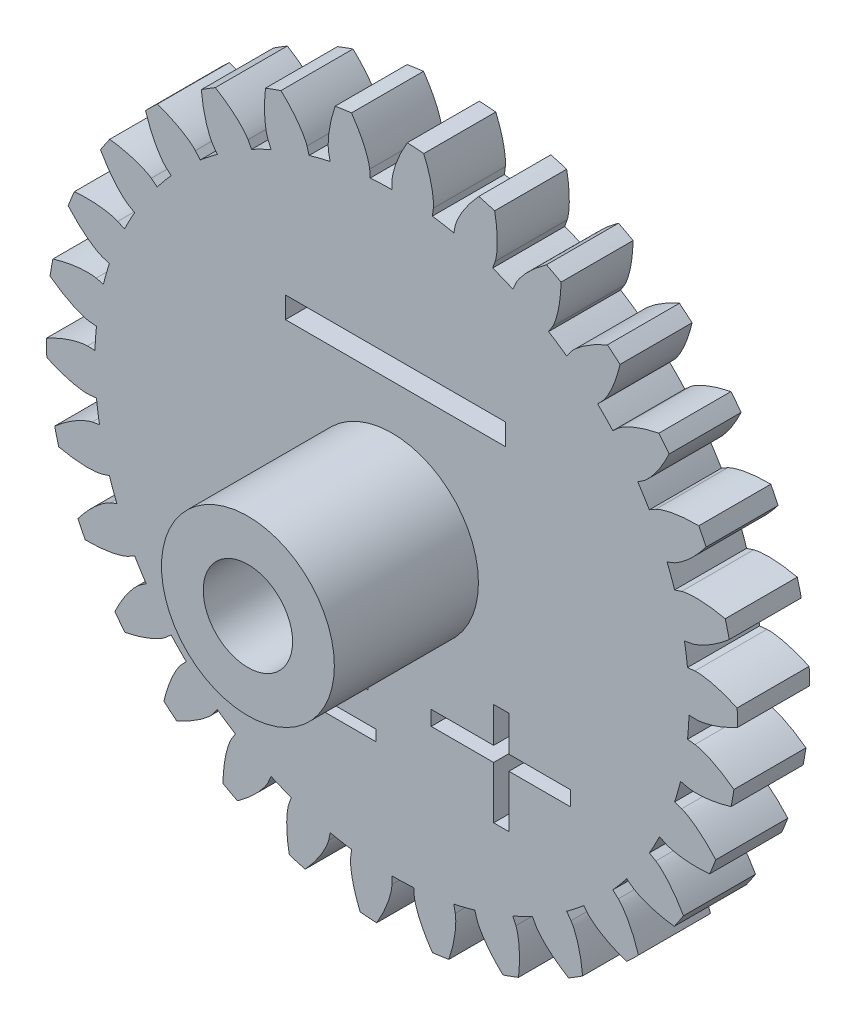
from build123d import *

# Parameters (mm, degrees)
EXTRUDE_1_DEPTH     = 5
SKETCH_3_R          = 3.1
CUT_EXTRUDE_1_DEPTH = 35.289661604
SKETCH_4_W          = 15.259984722
SKETCH_4_H          = 1.485485238
SKETCH_4_W_2        = 9.157676015
SKETCH_4_H_2        = 0.902934647
SKETCH_4_W_3        = 8.140290302
SKETCH_4_H_3        = 1.026013851
SKETCH_4_W_4        = 9.20419196
SKETCH_4_H_4        = 0.75747188
CUT_EXTRUDE_3_DEPTH = 35.289661604
EXTRUDE_START       = 10
SKETCH_5_R          = 6
SKETCH_5_R_2        = 3.1
EXTRUDE_3_DEPTH     = 10


with BuildPart() as part:
    # 草图2 → 凸台-拉伸1 (new body)
    with BuildSketch(Plane.XY):
        with BuildLine():
            ThreePointArc((2.204357203, 23.898552452), (1.633116974, 23.944371551), (1.060945599, 23.976538416))
            add(Edge.make_bspline(
                [(0, 21.143083968), (0.00037987, 21.160225435), (0.002621335, 21.208261377), (0.011495008, 21.298848828), (0.032544669, 21.445983805), (0.068954989, 21.632173974), (0.12697903, 21.870860387), (0.209261114, 22.149008274), (0.314210402, 22.450956335), (0.443724368, 22.774756342), (0.586524237, 23.093278709), (0.741139488, 23.406222172), (0.880596127, 23.665494038), (0.983335994, 23.845320999), (1.044263734, 23.948526579), (1.060945599, 23.976538416)],
                knots=[0, 0, 0, 0, 0, 0.005376748, 0.015083688, 0.02853182, 0.046610139, 0.064854849, 0.092110525, 0.119476175, 0.146842495, 0.174208853, 0.201574955, 0.228941013, 0.239167549, 0.239167549, 0.239167549, 0.239167549, 0.239167549], degree=4))
            add(Edge.make_bspline(
                [(0, 21.143083968), (0, 20.884041984), (0, 20.625)],
                knots=[0, 0, 0, 1, 1, 1], degree=2))
            ThreePointArc((0, 20.625), (-0.7551309, 20.611171784), (-1.509249231, 20.56970568))
            add(Edge.make_bspline(
                [(-1.547160398, 21.086400697), (-1.528204814, 20.828053189), (-1.509249231, 20.56970568)],
                knots=[0, 0, 0, 1, 1, 1], degree=2))
            add(Edge.make_bspline(
                [(-1.547160398, 21.086400697), (-1.548793589, 21.103468413), (-1.55454411, 21.151211552), (-1.570022795, 21.240906806), (-1.60178273, 21.386107), (-1.651720036, 21.569133653), (-1.727054569, 21.802934212), (-1.829469732, 22.074315352), (-1.956232924, 22.367774169), (-2.109093971, 22.681228811), (-2.274819106, 22.988447756), (-2.451919706, 23.289238155), (-2.609974876, 23.53761009), (-2.725598272, 23.709436882), (-2.793914811, 23.807907344), (-2.812601739, 23.834623376)],
                knots=[0, 0, 0, 0, 0, 0.005376748, 0.015083688, 0.02853182, 0.046610139, 0.064854849, 0.092110525, 0.119476175, 0.146842495, 0.174208853, 0.201574955, 0.228941013, 0.239167549, 0.239167549, 0.239167549, 0.239167549, 0.239167549], degree=4))
            ThreePointArc((-2.812601739, 23.834623376), (-3.380885325, 23.760673695), (-3.94724125, 23.673176519))
            add(Edge.make_bspline(
                [(-4.395894337, 20.681056855), (-4.399086679, 20.69790272), (-4.406881429, 20.745354988), (-4.417035858, 20.835807826), (-4.427037265, 20.984104021), (-4.43013371, 21.173795619), (-4.42300333, 21.419330038), (-4.400349503, 21.708507134), (-4.360472141, 22.025677089), (-4.301110173, 22.369328757), (-4.227655347, 22.710580408), (-4.141483415, 23.048831624), (-4.058979891, 23.331432443), (-3.995873263, 23.528690573), (-3.957734588, 23.642308453), (-3.94724125, 23.673176519)],
                knots=[0, 0, 0, 0, 0, 0.005376748, 0.015083688, 0.02853182, 0.046610139, 0.064854849, 0.092110525, 0.119476175, 0.146842495, 0.174208853, 0.201574955, 0.228941013, 0.239167549, 0.239167549, 0.239167549, 0.239167549, 0.239167549], degree=4))
            add(Edge.make_bspline(
                [(-4.395894337, 20.681056855), (-4.34203648, 20.42767556), (-4.288178623, 20.174294265)],
                knots=[0, 0, 0, 1, 1, 1], degree=2))
            ThreePointArc((-4.288178623, 20.174294265), (-5.023933053, 20.003767687), (-5.752950801, 19.806417699))
            add(Edge.make_bspline(
                [(-5.897460454, 20.303939516), (-5.825205628, 20.055178608), (-5.752950801, 19.806417699)],
                knots=[0, 0, 0, 1, 1, 1], degree=2))
            add(Edge.make_bspline(
                [(-5.897460454, 20.303939516), (-5.902606533, 20.320294701), (-5.918157748, 20.365798938), (-5.951946878, 20.450315936), (-6.013201601, 20.585739895), (-6.100101038, 20.754384427), (-6.2223992, 20.967412953), (-6.378999658, 21.211570454), (-6.564006288, 21.472260942), (-6.778697839, 21.74708425), (-7.004675893, 22.013133531), (-7.240444261, 22.270529653), (-7.446684975, 22.480612547), (-7.595506521, 22.624645056), (-7.68280334, 22.706759894), (-7.706636489, 22.729006886)],
                knots=[0, 0, 0, 0, 0, 0.005376748, 0.015083688, 0.02853182, 0.046610139, 0.064854849, 0.092110525, 0.119476175, 0.146842495, 0.174208853, 0.201574955, 0.228941013, 0.239167549, 0.239167549, 0.239167549, 0.239167549, 0.239167549], degree=4))
            ThreePointArc((-7.706636489, 22.729006886), (-8.247126712, 22.538520382), (-8.782914716, 22.335183212))
            add(Edge.make_bspline(
                [(-8.599666997, 19.315168319), (-8.606292031, 19.330982336), (-8.623782329, 19.375777039), (-8.652521061, 19.46214204), (-8.693136426, 19.605118199), (-8.735604308, 19.790020793), (-8.779679219, 20.031672186), (-8.817643732, 20.319240063), (-8.844581128, 20.637770063), (-8.857965561, 20.986254165), (-8.857066107, 21.335320766), (-8.843103621, 21.684096533), (-8.82115901, 21.977675294), (-8.800443685, 22.183743466), (-8.786760916, 22.302807999), (-8.782914716, 22.335183212)],
                knots=[0, 0, 0, 0, 0, 0.005376748, 0.015083688, 0.02853182, 0.046610139, 0.064854849, 0.092110525, 0.119476175, 0.146842495, 0.174208853, 0.201574955, 0.228941013, 0.239167549, 0.239167549, 0.239167549, 0.239167549, 0.239167549], degree=4))
            add(Edge.make_bspline(
                [(-8.599666997, 19.315168319), (-8.49430513, 19.078521692), (-8.388943263, 18.841875064)],
                knots=[0, 0, 0, 1, 1, 1], degree=2))
            ThreePointArc((-8.388943263, 18.841875064), (-9.073165225, 18.522102953), (-9.745220816, 18.177494223))
            add(Edge.make_bspline(
                [(-9.990013188, 18.634098748), (-9.867617002, 18.405796486), (-9.745220816, 18.177494223)],
                knots=[0, 0, 0, 1, 1, 1], degree=2))
            add(Edge.make_bspline(
                [(-9.990013188, 18.634098748), (-9.998447248, 18.649026603), (-10.023119494, 18.690303184), (-10.073742323, 18.765948128), (-10.161814707, 18.885677175), (-10.281878352, 19.032569011), (-10.445795127, 19.215515135), (-10.649736688, 19.421778143), (-10.88490108, 19.638306877), (-11.152040084, 19.862487753), (-11.428394731, 20.075739739), (-11.712526657, 20.278492138), (-11.957939207, 20.441104361), (-12.133454687, 20.551047675), (-12.235916496, 20.613218079), (-12.263854244, 20.63002373)],
                knots=[0, 0, 0, 0, 0, 0.005376748, 0.015083688, 0.02853182, 0.046610139, 0.064854849, 0.092110525, 0.119476175, 0.146842495, 0.174208853, 0.201574955, 0.228941013, 0.239167549, 0.239167549, 0.239167549, 0.239167549, 0.239167549], degree=4))
            ThreePointArc((-12.263854244, 20.63002373), (-12.752929087, 20.331325576), (-13.234732663, 20.021035222))
            add(Edge.make_bspline(
                [(-12.427592944, 17.105114243), (-12.437361125, 17.119205264), (-12.463782559, 17.159384657), (-12.509849575, 17.237887258), (-12.579303811, 17.369294635), (-12.659287079, 17.541327095), (-12.752640998, 17.768534136), (-12.849564619, 18.041924699), (-12.942139479, 18.347893455), (-13.027685348, 18.685979563), (-13.099380576, 19.027605228), (-13.158237764, 19.371662372), (-13.197811152, 19.663388273), (-13.220392489, 19.86926032), (-13.23176363, 19.988567815), (-13.234732663, 20.021035222)],
                knots=[0, 0, 0, 0, 0, 0.005376748, 0.015083688, 0.02853182, 0.046610139, 0.064854849, 0.092110525, 0.119476175, 0.146842495, 0.174208853, 0.201574955, 0.228941013, 0.239167549, 0.239167549, 0.239167549, 0.239167549, 0.239167549], degree=4))
            add(Edge.make_bspline(
                [(-12.427592944, 17.105114243), (-12.275331886, 16.895544876), (-12.123070829, 16.685975509)],
                knots=[0, 0, 0, 1, 1, 1], degree=2))
            ThreePointArc((-12.123070829, 16.685975509), (-12.725856538, 16.230933441), (-13.311577919, 15.754127025))
            add(Edge.make_bspline(
                [(-13.645954409, 16.149858449), (-13.478766164, 15.951992737), (-13.311577919, 15.754127025)],
                knots=[0, 0, 0, 1, 1, 1], degree=2))
            add(Edge.make_bspline(
                [(-13.645954409, 16.149858449), (-13.65730784, 16.162706555), (-13.690022822, 16.197951495), (-13.755266888, 16.261418338), (-13.866307748, 16.36021974), (-14.014288245, 16.478939001), (-14.212659683, 16.6238071), (-14.455029122, 16.78316093), (-14.730073464, 16.946064566), (-15.037984664, 17.10980523), (-15.35263788, 17.260939787), (-15.672715436, 17.400187211), (-15.946574115, 17.508221828), (-16.141112661, 17.579270897), (-16.254261388, 17.618779719), (-16.285082719, 17.629409543)],
                knots=[0, 0, 0, 0, 0, 0.005376748, 0.015083688, 0.02853182, 0.046610139, 0.064854849, 0.092110525, 0.119476175, 0.146842495, 0.174208853, 0.201574955, 0.228941013, 0.239167549, 0.239167549, 0.239167549, 0.239167549, 0.239167549], degree=4))
            ThreePointArc((-16.285082719, 17.629409543), (-16.701367266, 17.235554283), (-17.108129285, 16.831871921))
            add(Edge.make_bspline(
                [(-15.712373445, 14.147484596), (-15.724857855, 14.159236775), (-15.759055684, 14.193044827), (-15.820437633, 14.260254086), (-15.915695258, 14.374349549), (-16.029698259, 14.525993231), (-16.16825117, 14.728825881), (-16.319897872, 14.976090651), (-16.47406423, 15.25612586), (-16.628032772, 15.569037989), (-16.769189257, 15.888292037), (-16.898293776, 16.21259361), (-16.997655616, 16.48971683), (-17.062546702, 16.686395155), (-17.098474779, 16.800731302), (-17.108129285, 16.831871921)],
                knots=[0, 0, 0, 0, 0, 0.005376748, 0.015083688, 0.02853182, 0.046610139, 0.064854849, 0.092110525, 0.119476175, 0.146842495, 0.174208853, 0.201574955, 0.228941013, 0.239167549, 0.239167549, 0.239167549, 0.239167549, 0.239167549], degree=4))
            add(Edge.make_bspline(
                [(-15.712373445, 14.147484596), (-15.519867735, 13.974151676), (-15.327362025, 13.800818756)],
                knots=[0, 0, 0, 1, 1, 1], degree=2))
            ThreePointArc((-15.327362025, 13.800818756), (-15.822366855, 13.230394253), (-16.296155191, 12.642228878))
            add(Edge.make_bspline(
                [(-16.705501942, 12.95979184), (-16.500828566, 12.801010359), (-16.296155191, 12.642228878)],
                knots=[0, 0, 0, 1, 1, 1], degree=2))
            add(Edge.make_bspline(
                [(-16.705501942, 12.95979184), (-16.719278544, 12.969998673), (-16.75860646, 12.9976716), (-16.835620286, 13.046186535), (-16.964776603, 13.119742197), (-17.134206494, 13.205100282), (-17.358362811, 13.305558924), (-17.628567421, 13.411039051), (-17.931470954, 13.513197917), (-18.266697154, 13.609342117), (-18.605897083, 13.691753939), (-18.947931344, 13.761410606), (-19.238267214, 13.810145987), (-19.443326558, 13.839195625), (-19.56221706, 13.854316142), (-19.594574936, 13.858305563)],
                knots=[0, 0, 0, 0, 0, 0.005376748, 0.015083688, 0.02853182, 0.046610139, 0.064854849, 0.092110525, 0.119476175, 0.146842495, 0.174208853, 0.201574955, 0.228941013, 0.239167549, 0.239167549, 0.239167549, 0.239167549, 0.239167549], degree=4))
            ThreePointArc((-19.594574936, 13.858305563), (-19.919875554, 13.386506562), (-20.233818564, 12.907075049))
            add(Edge.make_bspline(
                [(-18.31044783, 10.571541984), (-18.325102842, 10.580441695), (-18.365582455, 10.606400832), (-18.439596652, 10.659379383), (-18.55649445, 10.751176412), (-18.699534706, 10.875803759), (-18.877231183, 11.045397259), (-19.076973277, 11.255729578), (-19.285993324, 11.497592357), (-19.501655373, 11.771654746), (-19.7061039, 12.054584244), (-19.899813264, 12.34495671), (-20.054620966, 12.595365635), (-20.158985749, 12.774254451), (-20.217900534, 12.878622212), (-20.233818564, 12.907075049)],
                knots=[0, 0, 0, 0, 0, 0.005376748, 0.015083688, 0.02853182, 0.046610139, 0.064854849, 0.092110525, 0.119476175, 0.146842495, 0.174208853, 0.201574955, 0.228941013, 0.239167549, 0.239167549, 0.239167549, 0.239167549, 0.239167549], degree=4))
            add(Edge.make_bspline(
                [(-18.31044783, 10.571541984), (-18.086110892, 10.442020992), (-17.861773953, 10.3125)],
                knots=[0, 0, 0, 1, 1, 1], degree=2))
            ThreePointArc((-17.861773953, 10.3125), (-18.227363817, 9.65162335), (-18.568512283, 8.977804666))
            add(Edge.make_bspline(
                [(-19.034938877, 9.20332014), (-18.80172558, 9.090562403), (-18.568512283, 8.977804666)],
                knots=[0, 0, 0, 1, 1, 1], degree=2))
            add(Edge.make_bspline(
                [(-19.034938877, 9.20332014), (-19.050536548, 9.210439613), (-19.09475858, 9.229331085), (-19.180176291, 9.260773778), (-19.321803315, 9.305868964), (-19.505277699, 9.354135315), (-19.745422189, 9.405793976), (-20.031652732, 9.452790412), (-20.349177118, 9.489739676), (-20.697067325, 9.514085448), (-21.045989303, 9.524172743), (-21.395031731, 9.521194324), (-21.68915572, 9.508500499), (-21.895773785, 9.494281097), (-22.015209976, 9.484352469), (-22.047690202, 9.481527131)],
                knots=[0, 0, 0, 0, 0, 0.005376748, 0.015083688, 0.02853182, 0.046610139, 0.064854849, 0.092110525, 0.119476175, 0.146842495, 0.174208853, 0.201574955, 0.228941013, 0.239167549, 0.239167549, 0.239167549, 0.239167549, 0.239167549], degree=4))
            ThreePointArc((-22.047690202, 9.481527131), (-22.267789693, 8.952404268), (-22.475192879, 8.418177062))
            add(Edge.make_bspline(
                [(-20.108267782, 6.53357226), (-20.1244529, 6.539230543), (-20.169445145, 6.556206225), (-20.252856814, 6.592638651), (-20.38628579, 6.658125276), (-20.552111756, 6.750289474), (-20.76118561, 6.879231775), (-21.000293408, 7.043439112), (-21.255031965, 7.236558897), (-21.522962056, 7.459793704), (-21.781767242, 7.694033275), (-22.031615422, 7.937785965), (-22.235103147, 8.150536523), (-22.374380386, 8.30381753), (-22.453707018, 8.393655532), (-22.475192879, 8.418177062)],
                knots=[0, 0, 0, 0, 0, 0.005376748, 0.015083688, 0.02853182, 0.046610139, 0.064854849, 0.092110525, 0.119476175, 0.146842495, 0.174208853, 0.201574955, 0.228941013, 0.239167549, 0.239167549, 0.239167549, 0.239167549, 0.239167549], degree=4))
            add(Edge.make_bspline(
                [(-20.108267782, 6.53357226), (-19.861904215, 6.453523884), (-19.615540649, 6.373475509)],
                knots=[0, 0, 0, 1, 1, 1], degree=2))
            ThreePointArc((-19.615540649, 6.373475509), (-19.835737515, 5.651030193), (-20.029336286, 4.921007309))
            add(Edge.make_bspline(
                [(-20.532457644, 5.044619187), (-20.280896965, 4.982813248), (-20.029336286, 4.921007309)],
                knots=[0, 0, 0, 1, 1, 1], degree=2))
            add(Edge.make_bspline(
                [(-20.532457644, 5.044619187), (-20.54919469, 5.048340144), (-20.596378122, 5.057624516), (-20.686466555, 5.070620769), (-20.834374505, 5.085284603), (-21.023874673, 5.094349749), (-21.269511869, 5.094950697), (-21.559258696, 5.081409472), (-21.877526597, 5.051534275), (-22.222876338, 5.003017592), (-22.566270801, 4.940339497), (-22.907066565, 4.864856162), (-23.192124045, 4.791287911), (-23.39127063, 4.734420926), (-23.506032576, 4.699877083), (-23.537215611, 4.690360466)],
                knots=[0, 0, 0, 0, 0, 0.005376748, 0.015083688, 0.02853182, 0.046610139, 0.064854849, 0.092110525, 0.119476175, 0.146842495, 0.174208853, 0.201574955, 0.228941013, 0.239167549, 0.239167549, 0.239167549, 0.239167549, 0.239167549], degree=4))
            ThreePointArc((-23.537215611, 4.690360466), (-23.64249457, 4.12703895), (-23.734293417, 3.561364343))
            add(Edge.make_bspline(
                [(-21.027259941, 2.210054076), (-21.044267799, 2.212223637), (-21.091806298, 2.219473946), (-21.18096995, 2.237767974), (-21.325098617, 2.274082116), (-21.506462902, 2.329755149), (-21.737776603, 2.412410852), (-22.005799947, 2.523316558), (-22.295123716, 2.659253089), (-22.603612018, 2.821903881), (-22.905462834, 2.997216131), (-23.200530266, 3.183695883), (-23.443804625, 3.349489853), (-23.611907235, 3.470463937), (-23.708178761, 3.541845829), (-23.734293417, 3.561364343)],
                knots=[0, 0, 0, 0, 0, 0.005376748, 0.015083688, 0.02853182, 0.046610139, 0.064854849, 0.092110525, 0.119476175, 0.146842495, 0.174208853, 0.201574955, 0.228941013, 0.239167549, 0.239167549, 0.239167549, 0.239167549, 0.239167549], degree=4))
            add(Edge.make_bspline(
                [(-21.027259941, 2.210054076), (-20.769637017, 2.182976815), (-20.512014092, 2.155899555)],
                knots=[0, 0, 0, 1, 1, 1], degree=2))
            ThreePointArc((-20.512014092, 2.155899555), (-20.577194301, 1.403459899), (-20.614782183, 0.649138319))
            add(Edge.make_bspline(
                [(-21.132609487, 0.665444169), (-20.873695835, 0.657291244), (-20.614782183, 0.649138319)],
                knots=[0, 0, 0, 1, 1, 1], degree=2))
            add(Edge.make_bspline(
                [(-21.132609487, 0.665444169), (-21.149754418, 0.665603987), (-21.197837109, 0.664875485), (-21.288658966, 0.658857301), (-21.436383555, 0.642448903), (-21.623627439, 0.611916654), (-21.864021817, 0.561433625), (-22.144621602, 0.487946556), (-22.449723183, 0.392552585), (-22.777439018, 0.273293859), (-23.100297979, 0.140589708), (-23.417952671, -0.004099559), (-23.681485262, -0.135326949), (-23.864456705, -0.232356157), (-23.969528758, -0.290005485), (-23.998051752, -0.305797458)],
                knots=[0, 0, 0, 0, 0, 0.005376748, 0.015083688, 0.02853182, 0.046610139, 0.064854849, 0.092110525, 0.119476175, 0.146842495, 0.174208853, 0.201574955, 0.228941013, 0.239167549, 0.239167549, 0.239167549, 0.239167549, 0.239167549], degree=4))
            ThreePointArc((-23.998051752, -0.305797458), (-23.983908985, -0.878697774), (-23.956091443, -1.451097087))
            add(Edge.make_bspline(
                [(-21.027259941, -2.210054076), (-21.044347214, -2.211468058), (-21.092354306, -2.214259995), (-21.183373061, -2.2149039), (-21.331902306, -2.209349345), (-21.52087842, -2.192600657), (-21.764322448, -2.159844002), (-22.049547432, -2.107087038), (-22.360811577, -2.03427484), (-22.69637567, -1.939316682), (-23.028079789, -1.830593739), (-23.35547061, -1.709536986), (-23.627899345, -1.597945595), (-23.817480436, -1.514565583), (-23.926489328, -1.464759533), (-23.956091443, -1.451097087)],
                knots=[0, 0, 0, 0, 0, 0.005376748, 0.015083688, 0.02853182, 0.046610139, 0.064854849, 0.092110525, 0.119476175, 0.146842495, 0.174208853, 0.201574955, 0.228941013, 0.239167549, 0.239167549, 0.239167549, 0.239167549, 0.239167549], degree=4))
            add(Edge.make_bspline(
                [(-21.027259941, -2.210054076), (-20.769637017, -2.182976815), (-20.512014092, -2.155899555)],
                knots=[0, 0, 0, 1, 1, 1], degree=2))
            ThreePointArc((-20.512014092, -2.155899555), (-20.419328956, -2.905448326), (-20.299263177, -3.65110113))
            add(Edge.make_bspline(
                [(-20.809164889, -3.742813952), (-20.554214033, -3.696957541), (-20.299263177, -3.65110113)],
                knots=[0, 0, 0, 1, 1, 1], degree=2))
            add(Edge.make_bspline(
                [(-20.809164889, -3.742813952), (-20.825968391, -3.746222259), (-20.872848895, -3.756931794), (-20.960434826, -3.781701392), (-21.10151978, -3.828464897), (-21.278323925, -3.897260136), (-21.502969097, -3.996620791), (-21.762158283, -4.126841967), (-22.04075914, -4.283585536), (-22.336518315, -4.468374126), (-22.624731289, -4.665304526), (-22.905361873, -4.872876109), (-23.135851936, -5.056027373), (-23.294651507, -5.188978162), (-23.385441515, -5.267213422), (-23.410057877, -5.288590566)],
                knots=[0, 0, 0, 0, 0, 0.005376748, 0.015083688, 0.02853182, 0.046610139, 0.064854849, 0.092110525, 0.119476175, 0.146842495, 0.174208853, 0.201574955, 0.228941013, 0.239167549, 0.239167549, 0.239167549, 0.239167549, 0.239167549], degree=4))
            ThreePointArc((-23.410057877, -5.288590566), (-23.27711149, -5.846031189), (-23.130893319, -6.400138612))
            add(Edge.make_bspline(
                [(-20.108267782, -6.53357226), (-20.124687673, -6.538507986), (-20.171065219, -6.551220148), (-20.25996112, -6.570773846), (-20.406399502, -6.596221638), (-20.594728282, -6.619129292), (-20.839662966, -6.637703308), (-21.129623889, -6.645400819), (-21.449224673, -6.638895197), (-21.797198797, -6.615779801), (-22.144259155, -6.578397879), (-22.489664816, -6.528054886), (-22.779341484, -6.475543153), (-22.982115452, -6.43340132), (-23.099097499, -6.407347874), (-23.130893319, -6.400138612)],
                knots=[0, 0, 0, 0, 0, 0.005376748, 0.015083688, 0.02853182, 0.046610139, 0.064854849, 0.092110525, 0.119476175, 0.146842495, 0.174208853, 0.201574955, 0.228941013, 0.239167549, 0.239167549, 0.239167549, 0.239167549, 0.239167549], degree=4))
            add(Edge.make_bspline(
                [(-20.108267782, -6.53357226), (-19.861904215, -6.453523884), (-19.615540649, -6.373475509)],
                knots=[0, 0, 0, 1, 1, 1], degree=2))
            ThreePointArc((-19.615540649, -6.373475509), (-19.369040953, -7.087374518), (-19.096568964, -7.79176994))
            add(Edge.make_bspline(
                [(-19.576259932, -7.987493144), (-19.336414448, -7.889631542), (-19.096568964, -7.79176994)],
                knots=[0, 0, 0, 1, 1, 1], degree=2))
            add(Edge.make_bspline(
                [(-19.576259932, -7.987493144), (-19.59198761, -7.994320615), (-19.635617026, -8.014543127), (-19.716139105, -8.056981588), (-19.844418335, -8.13205641), (-20.00305555, -8.236107956), (-20.202133445, -8.3800037), (-20.42858422, -8.561267693), (-20.66850816, -8.772510414), (-20.919384579, -9.01475272), (-21.160355275, -9.267302565), (-21.391696849, -9.52868459), (-21.579070862, -9.755755138), (-21.706758259, -9.918816921), (-21.779298261, -10.014218857), (-21.798932139, -10.040246889)],
                knots=[0, 0, 0, 0, 0, 0.005376748, 0.015083688, 0.02853182, 0.046610139, 0.064854849, 0.092110525, 0.119476175, 0.146842495, 0.174208853, 0.201574955, 0.228941013, 0.239167549, 0.239167549, 0.239167549, 0.239167549, 0.239167549], degree=4))
            ThreePointArc((-21.798932139, -10.040246889), (-21.552992527, -10.557864989), (-21.294764163, -11.069463368))
            add(Edge.make_bspline(
                [(-18.31044783, -10.571541984), (-18.325482712, -10.57978374), (-18.36820379, -10.601860545), (-18.45109166, -10.639469445), (-18.589039118, -10.694807393), (-18.768489694, -10.756370215), (-19.004210213, -10.825463128), (-19.286234391, -10.893278696), (-19.600203726, -10.953363977), (-19.945379742, -11.003101596), (-20.292628137, -11.038694465), (-20.640952752, -11.061265462), (-20.935217093, -11.070128402), (-21.142321743, -11.071066548), (-21.262164268, -11.069904368), (-21.294764163, -11.069463368)],
                knots=[0, 0, 0, 0, 0, 0.005376748, 0.015083688, 0.02853182, 0.046610139, 0.064854849, 0.092110525, 0.119476175, 0.146842495, 0.174208853, 0.201574955, 0.228941013, 0.239167549, 0.239167549, 0.239167549, 0.239167549, 0.239167549], degree=4))
            add(Edge.make_bspline(
                [(-18.31044783, -10.571541984), (-18.086110892, -10.442020992), (-17.861773953, -10.3125)],
                knots=[0, 0, 0, 1, 1, 1], degree=2))
            ThreePointArc((-17.861773953, -10.3125), (-17.472232917, -10.959548434), (-17.059263052, -11.591901014))
            add(Edge.make_bspline(
                [(-17.487778479, -11.883080557), (-17.273520766, -11.737490786), (-17.059263052, -11.591901014)],
                knots=[0, 0, 0, 1, 1, 1], degree=2))
            add(Edge.make_bspline(
                [(-17.487778479, -11.883080557), (-17.501742959, -11.8930288), (-17.54021447, -11.921880466), (-17.610153496, -11.980133028), (-17.720020585, -12.080238036), (-17.853557663, -12.214998338), (-18.018367621, -12.397140236), (-18.202183, -12.62152494), (-18.392944194, -12.878034492), (-18.587973354, -13.167143363), (-18.771170197, -13.464275013), (-18.943112024, -13.768043831), (-19.079180844, -14.029109591), (-19.170175513, -14.215155785), (-19.221295165, -14.323554874), (-19.235088463, -14.353096244)],
                knots=[0, 0, 0, 0, 0, 0.005376748, 0.015083688, 0.02853182, 0.046610139, 0.064854849, 0.092110525, 0.119476175, 0.146842495, 0.174208853, 0.201574955, 0.228941013, 0.239167549, 0.239167549, 0.239167549, 0.239167549, 0.239167549], degree=4))
            ThreePointArc((-19.235088463, -14.353096244), (-18.886904368, -14.808269426), (-18.527951629, -15.254999457))
            add(Edge.make_bspline(
                [(-15.712373445, -14.147484596), (-15.725366221, -14.158672178), (-15.762563715, -14.189148763), (-15.835820956, -14.243169175), (-15.959248526, -14.325978745), (-16.121978046, -14.423506145), (-16.33818228, -14.540098264), (-16.599943905, -14.665068023), (-16.894559824, -14.789118191), (-17.221851883, -14.909535053), (-17.554111894, -15.016547133), (-17.890132006, -15.111045659), (-18.176123257, -15.18089592), (-18.378507122, -15.224873043), (-18.495972431, -15.248652921), (-18.527951629, -15.254999457)],
                knots=[0, 0, 0, 0, 0, 0.005376748, 0.015083688, 0.02853182, 0.046610139, 0.064854849, 0.092110525, 0.119476175, 0.146842495, 0.174208853, 0.201574955, 0.228941013, 0.239167549, 0.239167549, 0.239167549, 0.239167549, 0.239167549], degree=4))
            add(Edge.make_bspline(
                [(-15.712373445, -14.147484596), (-15.519867735, -13.974151676), (-15.327362025, -13.800818756)],
                knots=[0, 0, 0, 1, 1, 1], degree=2))
            ThreePointArc((-15.327362025, -13.800818756), (-14.811804462, -14.352737494), (-14.276385485, -14.88541039))
            add(Edge.make_bspline(
                [(-14.634997191, -15.259320329), (-14.455691338, -15.072365359), (-14.276385485, -14.88541039)],
                knots=[0, 0, 0, 1, 1, 1], degree=2))
            add(Edge.make_bspline(
                [(-14.634997191, -15.259320329), (-14.646588157, -15.271954557), (-14.678220375, -15.308174422), (-14.734519677, -15.379695166), (-14.821172904, -15.500455292), (-14.923773635, -15.660034678), (-15.047112669, -15.872462256), (-15.180259038, -16.130160981), (-15.313520308, -16.420726667), (-15.444178499, -16.744066658), (-15.561594908, -17.072794034), (-15.666622305, -17.405673491), (-15.745439071, -17.689324635), (-15.79576411, -17.89022413), (-15.823229236, -18.006882812), (-15.830579122, -18.03864642)],
                knots=[0, 0, 0, 0, 0, 0.005376748, 0.015083688, 0.02853182, 0.046610139, 0.064854849, 0.092110525, 0.119476175, 0.146842495, 0.174208853, 0.201574955, 0.228941013, 0.239167549, 0.239167549, 0.239167549, 0.239167549, 0.239167549], degree=4))
            ThreePointArc((-15.830579122, -18.03864642), (-15.395367858, -18.411481432), (-14.951378702, -18.773818869))
            add(Edge.make_bspline(
                [(-12.427592944, -17.105114243), (-12.437975768, -17.1187587), (-12.468023969, -17.156303093), (-12.528448888, -17.224374066), (-12.631962191, -17.331036083), (-12.770858594, -17.460265645), (-12.958097383, -17.619261334), (-13.188156214, -17.795923506), (-13.450542588, -17.978516974), (-13.745646457, -18.164350284), (-14.048396728, -18.338104634), (-14.357426646, -18.50040065), (-14.622645615, -18.62818544), (-14.81146355, -18.713279529), (-14.921417845, -18.76096217), (-14.951378702, -18.773818869)],
                knots=[0, 0, 0, 0, 0, 0.005376748, 0.015083688, 0.02853182, 0.046610139, 0.064854849, 0.092110525, 0.119476175, 0.146842495, 0.174208853, 0.201574955, 0.228941013, 0.239167549, 0.239167549, 0.239167549, 0.239167549, 0.239167549], degree=4))
            add(Edge.make_bspline(
                [(-12.427592944, -17.105114243), (-12.275331886, -16.895544876), (-12.123070829, -16.685975509)],
                knots=[0, 0, 0, 1, 1, 1], degree=2))
            ThreePointArc((-12.123070829, -16.685975509), (-11.504029077, -17.118643054), (-10.869561366, -17.528355904))
            add(Edge.make_bspline(
                [(-11.142596299, -17.968654579), (-11.006078832, -17.748505242), (-10.869561366, -17.528355904)],
                knots=[0, 0, 0, 1, 1, 1], degree=2))
            add(Edge.make_bspline(
                [(-11.142596299, -17.968654579), (-11.151307171, -17.983422617), (-11.174717615, -18.025427699), (-11.214916643, -18.107090826), (-11.274568848, -18.243228272), (-11.341749087, -18.420652357), (-11.41822669, -18.65408151), (-11.494884914, -18.933831587), (-11.564822102, -19.245754292), (-11.625398934, -19.589193893), (-11.671903248, -19.935150031), (-11.705426014, -20.282591697), (-11.723546055, -20.576431311), (-11.731002018, -20.783403833), (-11.733612262, -20.903223564), (-11.734197509, -20.935821188)],
                knots=[0, 0, 0, 0, 0, 0.005376748, 0.015083688, 0.02853182, 0.046610139, 0.064854849, 0.092110525, 0.119476175, 0.146842495, 0.174208853, 0.201574955, 0.228941013, 0.239167549, 0.239167549, 0.239167549, 0.239167549, 0.239167549], degree=4))
            ThreePointArc((-11.734197509, -20.935821188), (-11.230979898, -21.21002335), (-10.721358781, -21.472132309))
            add(Edge.make_bspline(
                [(-8.599666997, -19.315168319), (-8.606986089, -19.330673322), (-8.628571747, -19.373644652), (-8.673523486, -19.452791158), (-8.752598494, -19.57864398), (-8.861591341, -19.733927752), (-9.011681451, -19.928378137), (-9.199982813, -20.149011737), (-9.418672099, -20.382168295), (-9.668690323, -20.625296246), (-9.928699212, -20.858198967), (-10.197232846, -21.081199358), (-10.430088193, -21.261333868), (-10.597087947, -21.383825903), (-10.694725698, -21.453327348), (-10.721358781, -21.472132309)],
                knots=[0, 0, 0, 0, 0, 0.005376748, 0.015083688, 0.02853182, 0.046610139, 0.064854849, 0.092110525, 0.119476175, 0.146842495, 0.174208853, 0.201574955, 0.228941013, 0.239167549, 0.239167549, 0.239167549, 0.239167549, 0.239167549], degree=4))
            add(Edge.make_bspline(
                [(-8.599666997, -19.315168319), (-8.49430513, -19.078521692), (-8.388943263, -18.841875064)],
                knots=[0, 0, 0, 1, 1, 1], degree=2))
            ThreePointArc((-8.388943263, -18.841875064), (-7.693472418, -19.136381767), (-6.987685258, -19.405228155))
            add(Edge.make_bspline(
                [(-7.16321048, -19.892672402), (-7.075447869, -19.648950278), (-6.987685258, -19.405228155)],
                knots=[0, 0, 0, 1, 1, 1], degree=2))
            add(Edge.make_bspline(
                [(-7.16321048, -19.892672402), (-7.168660551, -19.908928814), (-7.182826073, -19.95488329), (-7.205167938, -20.04311973), (-7.235212032, -20.188684637), (-7.26403568, -20.376199137), (-7.290309414, -20.620427891), (-7.30712916, -20.910002898), (-7.310685676, -21.229650102), (-7.298533651, -21.578179356), (-7.272093409, -21.926244313), (-7.232646437, -22.273063319), (-7.189277821, -22.564249201), (-7.153538846, -22.768249059), (-7.131180127, -22.885993141), (-7.124975158, -22.918000109)],
                knots=[0, 0, 0, 0, 0, 0.005376748, 0.015083688, 0.02853182, 0.046610139, 0.064854849, 0.092110525, 0.119476175, 0.146842495, 0.174208853, 0.201574955, 0.228941013, 0.239167549, 0.239167549, 0.239167549, 0.239167549, 0.239167549], degree=4))
            ThreePointArc((-7.124975158, -22.918000109), (-6.575744224, -23.081585472), (-6.022764034, -23.232010533))
            add(Edge.make_bspline(
                [(-4.395894337, -20.681056855), (-4.399829818, -20.697744761), (-4.412009535, -20.744264975), (-4.439523487, -20.831027933), (-4.490704244, -20.970571187), (-4.565030024, -21.145122523), (-4.671411796, -21.366529189), (-4.809726017, -21.62149147), (-4.975160443, -21.895021057), (-5.169166025, -22.18481779), (-5.375069898, -22.466689916), (-5.59137104, -22.740648496), (-5.781685868, -22.965259983), (-5.919568751, -23.119796474), (-6.00062272, -23.208079176), (-6.022764034, -23.232010533)],
                knots=[0, 0, 0, 0, 0, 0.005376748, 0.015083688, 0.02853182, 0.046610139, 0.064854849, 0.092110525, 0.119476175, 0.146842495, 0.174208853, 0.201574955, 0.228941013, 0.239167549, 0.239167549, 0.239167549, 0.239167549, 0.239167549], degree=4))
            add(Edge.make_bspline(
                [(-4.395894337, -20.681056855), (-4.34203648, -20.42767556), (-4.288178623, -20.174294265)],
                knots=[0, 0, 0, 1, 1, 1], degree=2))
            ThreePointArc((-4.288178623, -20.174294265), (-3.546674098, -20.317768771), (-2.800413774, -20.433998818))
            add(Edge.make_bspline(
                [(-2.870757991, -20.947284985), (-2.835585882, -20.690641901), (-2.800413774, -20.433998818)],
                knots=[0, 0, 0, 1, 1, 1], degree=2))
            add(Edge.make_bspline(
                [(-2.870757991, -20.947284985), (-2.872709066, -20.964319289), (-2.877010565, -21.012214726), (-2.880518819, -21.103168124), (-2.879641732, -21.251798606), (-2.868849057, -21.441208238), (-2.843770634, -21.685562624), (-2.800016799, -21.972306745), (-2.737037206, -22.285708332), (-2.652687425, -22.624094837), (-2.554458192, -22.959056504), (-2.443765505, -23.290095197), (-2.340803648, -23.565901126), (-2.2634317, -23.758012546), (-2.217081201, -23.868534999), (-2.204357203, -23.898552452)],
                knots=[0, 0, 0, 0, 0, 0.005376748, 0.015083688, 0.02853182, 0.046610139, 0.064854849, 0.092110525, 0.119476175, 0.146842495, 0.174208853, 0.201574955, 0.228941013, 0.239167549, 0.239167549, 0.239167549, 0.239167549, 0.239167549], degree=4))
            ThreePointArc((-2.204357203, -23.898552452), (-1.633116974, -23.944371551), (-1.060945599, -23.976538416))
            add(Edge.make_bspline(
                [(0, -21.143083968), (-0.00037987, -21.160225435), (-0.002621335, -21.208261377), (-0.011495008, -21.298848828), (-0.032544669, -21.445983805), (-0.068954989, -21.632173974), (-0.12697903, -21.870860387), (-0.209261114, -22.149008274), (-0.314210402, -22.450956335), (-0.443724368, -22.774756342), (-0.586524237, -23.093278709), (-0.741139488, -23.406222172), (-0.880596127, -23.665494038), (-0.983335994, -23.845320999), (-1.044263734, -23.948526579), (-1.060945599, -23.976538416)],
                knots=[0, 0, 0, 0, 0, 0.005376748, 0.015083688, 0.02853182, 0.046610139, 0.064854849, 0.092110525, 0.119476175, 0.146842495, 0.174208853, 0.201574955, 0.228941013, 0.239167549, 0.239167549, 0.239167549, 0.239167549, 0.239167549], degree=4))
            add(Edge.make_bspline(
                [(0, -21.143083968), (0, -20.884041984), (0, -20.625)],
                knots=[0, 0, 0, 1, 1, 1], degree=2))
            ThreePointArc((0, -20.625), (0.7551309, -20.611171784), (1.509249231, -20.56970568))
            add(Edge.make_bspline(
                [(1.547160398, -21.086400697), (1.528204814, -20.828053189), (1.509249231, -20.56970568)],
                knots=[0, 0, 0, 1, 1, 1], degree=2))
            add(Edge.make_bspline(
                [(1.547160398, -21.086400697), (1.548793589, -21.103468413), (1.55454411, -21.151211552), (1.570022795, -21.240906806), (1.60178273, -21.386107), (1.651720036, -21.569133653), (1.727054569, -21.802934212), (1.829469732, -22.074315352), (1.956232924, -22.367774169), (2.109093971, -22.681228811), (2.274819106, -22.988447756), (2.451919706, -23.289238155), (2.609974876, -23.53761009), (2.725598272, -23.709436882), (2.793914811, -23.807907344), (2.812601739, -23.834623376)],
                knots=[0, 0, 0, 0, 0, 0.005376748, 0.015083688, 0.02853182, 0.046610139, 0.064854849, 0.092110525, 0.119476175, 0.146842495, 0.174208853, 0.201574955, 0.228941013, 0.239167549, 0.239167549, 0.239167549, 0.239167549, 0.239167549], degree=4))
            ThreePointArc((2.812601739, -23.834623376), (3.380885325, -23.760673695), (3.94724125, -23.673176519))
            add(Edge.make_bspline(
                [(4.395894337, -20.681056855), (4.399086679, -20.69790272), (4.406881429, -20.745354988), (4.417035858, -20.835807826), (4.427037265, -20.984104021), (4.43013371, -21.173795619), (4.42300333, -21.419330038), (4.400349503, -21.708507134), (4.360472141, -22.025677089), (4.301110173, -22.369328757), (4.227655347, -22.710580408), (4.141483415, -23.048831624), (4.058979891, -23.331432443), (3.995873263, -23.528690573), (3.957734588, -23.642308453), (3.94724125, -23.673176519)],
                knots=[0, 0, 0, 0, 0, 0.005376748, 0.015083688, 0.02853182, 0.046610139, 0.064854849, 0.092110525, 0.119476175, 0.146842495, 0.174208853, 0.201574955, 0.228941013, 0.239167549, 0.239167549, 0.239167549, 0.239167549, 0.239167549], degree=4))
            add(Edge.make_bspline(
                [(4.395894337, -20.681056855), (4.34203648, -20.42767556), (4.288178623, -20.174294265)],
                knots=[0, 0, 0, 1, 1, 1], degree=2))
            ThreePointArc((4.288178623, -20.174294265), (5.023933053, -20.003767687), (5.752950801, -19.806417699))
            add(Edge.make_bspline(
                [(5.897460454, -20.303939516), (5.825205628, -20.055178608), (5.752950801, -19.806417699)],
                knots=[0, 0, 0, 1, 1, 1], degree=2))
            add(Edge.make_bspline(
                [(5.897460454, -20.303939516), (5.902606533, -20.320294701), (5.918157748, -20.365798938), (5.951946878, -20.450315936), (6.013201601, -20.585739895), (6.100101038, -20.754384427), (6.2223992, -20.967412953), (6.378999658, -21.211570454), (6.564006288, -21.472260942), (6.778697839, -21.74708425), (7.004675893, -22.013133531), (7.240444261, -22.270529653), (7.446684975, -22.480612547), (7.595506521, -22.624645056), (7.68280334, -22.706759894), (7.706636489, -22.729006886)],
                knots=[0, 0, 0, 0, 0, 0.005376748, 0.015083688, 0.02853182, 0.046610139, 0.064854849, 0.092110525, 0.119476175, 0.146842495, 0.174208853, 0.201574955, 0.228941013, 0.239167549, 0.239167549, 0.239167549, 0.239167549, 0.239167549], degree=4))
            ThreePointArc((7.706636489, -22.729006886), (8.247126712, -22.538520382), (8.782914716, -22.335183212))
            add(Edge.make_bspline(
                [(8.599666997, -19.315168319), (8.606292031, -19.330982336), (8.623782329, -19.375777039), (8.652521061, -19.46214204), (8.693136426, -19.605118199), (8.735604308, -19.790020793), (8.779679219, -20.031672186), (8.817643732, -20.319240063), (8.844581128, -20.637770063), (8.857965561, -20.986254165), (8.857066107, -21.335320766), (8.843103621, -21.684096533), (8.82115901, -21.977675294), (8.800443685, -22.183743466), (8.786760916, -22.302807999), (8.782914716, -22.335183212)],
                knots=[0, 0, 0, 0, 0, 0.005376748, 0.015083688, 0.02853182, 0.046610139, 0.064854849, 0.092110525, 0.119476175, 0.146842495, 0.174208853, 0.201574955, 0.228941013, 0.239167549, 0.239167549, 0.239167549, 0.239167549, 0.239167549], degree=4))
            add(Edge.make_bspline(
                [(8.599666997, -19.315168319), (8.49430513, -19.078521692), (8.388943263, -18.841875064)],
                knots=[0, 0, 0, 1, 1, 1], degree=2))
            ThreePointArc((8.388943263, -18.841875064), (9.073165225, -18.522102953), (9.745220816, -18.177494223))
            add(Edge.make_bspline(
                [(9.990013188, -18.634098748), (9.867617002, -18.405796486), (9.745220816, -18.177494223)],
                knots=[0, 0, 0, 1, 1, 1], degree=2))
            add(Edge.make_bspline(
                [(9.990013188, -18.634098748), (9.998447248, -18.649026603), (10.023119494, -18.690303184), (10.073742323, -18.765948128), (10.161814707, -18.885677175), (10.281878352, -19.032569011), (10.445795127, -19.215515135), (10.649736688, -19.421778143), (10.88490108, -19.638306877), (11.152040084, -19.862487753), (11.428394731, -20.075739739), (11.712526657, -20.278492138), (11.957939207, -20.441104361), (12.133454687, -20.551047675), (12.235916496, -20.613218079), (12.263854244, -20.63002373)],
                knots=[0, 0, 0, 0, 0, 0.005376748, 0.015083688, 0.02853182, 0.046610139, 0.064854849, 0.092110525, 0.119476175, 0.146842495, 0.174208853, 0.201574955, 0.228941013, 0.239167549, 0.239167549, 0.239167549, 0.239167549, 0.239167549], degree=4))
            ThreePointArc((12.263854244, -20.63002373), (12.752929087, -20.331325576), (13.234732663, -20.021035222))
            add(Edge.make_bspline(
                [(12.427592944, -17.105114243), (12.437361125, -17.119205264), (12.463782559, -17.159384657), (12.509849575, -17.237887258), (12.579303811, -17.369294635), (12.659287079, -17.541327095), (12.752640998, -17.768534136), (12.849564619, -18.041924699), (12.942139479, -18.347893455), (13.027685348, -18.685979563), (13.099380576, -19.027605228), (13.158237764, -19.371662372), (13.197811152, -19.663388273), (13.220392489, -19.86926032), (13.23176363, -19.988567815), (13.234732663, -20.021035222)],
                knots=[0, 0, 0, 0, 0, 0.005376748, 0.015083688, 0.02853182, 0.046610139, 0.064854849, 0.092110525, 0.119476175, 0.146842495, 0.174208853, 0.201574955, 0.228941013, 0.239167549, 0.239167549, 0.239167549, 0.239167549, 0.239167549], degree=4))
            add(Edge.make_bspline(
                [(12.427592944, -17.105114243), (12.275331886, -16.895544876), (12.123070829, -16.685975509)],
                knots=[0, 0, 0, 1, 1, 1], degree=2))
            ThreePointArc((12.123070829, -16.685975509), (12.725856538, -16.230933441), (13.311577919, -15.754127025))
            add(Edge.make_bspline(
                [(13.645954409, -16.149858449), (13.478766164, -15.951992737), (13.311577919, -15.754127025)],
                knots=[0, 0, 0, 1, 1, 1], degree=2))
            add(Edge.make_bspline(
                [(13.645954409, -16.149858449), (13.65730784, -16.162706555), (13.690022822, -16.197951495), (13.755266888, -16.261418338), (13.866307748, -16.36021974), (14.014288245, -16.478939001), (14.212659683, -16.6238071), (14.455029122, -16.78316093), (14.730073464, -16.946064566), (15.037984664, -17.10980523), (15.35263788, -17.260939787), (15.672715436, -17.400187211), (15.946574115, -17.508221828), (16.141112661, -17.579270897), (16.254261388, -17.618779719), (16.285082719, -17.629409543)],
                knots=[0, 0, 0, 0, 0, 0.005376748, 0.015083688, 0.02853182, 0.046610139, 0.064854849, 0.092110525, 0.119476175, 0.146842495, 0.174208853, 0.201574955, 0.228941013, 0.239167549, 0.239167549, 0.239167549, 0.239167549, 0.239167549], degree=4))
            ThreePointArc((16.285082719, -17.629409543), (16.701367266, -17.235554283), (17.108129285, -16.831871921))
            add(Edge.make_bspline(
                [(15.712373445, -14.147484596), (15.724857855, -14.159236775), (15.759055684, -14.193044827), (15.820437633, -14.260254086), (15.915695258, -14.374349549), (16.029698259, -14.525993231), (16.16825117, -14.728825881), (16.319897872, -14.976090651), (16.47406423, -15.25612586), (16.628032772, -15.569037989), (16.769189257, -15.888292037), (16.898293776, -16.21259361), (16.997655616, -16.48971683), (17.062546702, -16.686395155), (17.098474779, -16.800731302), (17.108129285, -16.831871921)],
                knots=[0, 0, 0, 0, 0, 0.005376748, 0.015083688, 0.02853182, 0.046610139, 0.064854849, 0.092110525, 0.119476175, 0.146842495, 0.174208853, 0.201574955, 0.228941013, 0.239167549, 0.239167549, 0.239167549, 0.239167549, 0.239167549], degree=4))
            add(Edge.make_bspline(
                [(15.712373445, -14.147484596), (15.519867735, -13.974151676), (15.327362025, -13.800818756)],
                knots=[0, 0, 0, 1, 1, 1], degree=2))
            ThreePointArc((15.327362025, -13.800818756), (15.822366855, -13.230394253), (16.296155191, -12.642228878))
            add(Edge.make_bspline(
                [(16.705501942, -12.95979184), (16.500828566, -12.801010359), (16.296155191, -12.642228878)],
                knots=[0, 0, 0, 1, 1, 1], degree=2))
            add(Edge.make_bspline(
                [(16.705501942, -12.95979184), (16.719278544, -12.969998673), (16.75860646, -12.9976716), (16.835620286, -13.046186535), (16.964776603, -13.119742197), (17.134206494, -13.205100282), (17.358362811, -13.305558924), (17.628567421, -13.411039051), (17.931470954, -13.513197917), (18.266697154, -13.609342117), (18.605897083, -13.691753939), (18.947931344, -13.761410606), (19.238267214, -13.810145987), (19.443326558, -13.839195625), (19.56221706, -13.854316142), (19.594574936, -13.858305563)],
                knots=[0, 0, 0, 0, 0, 0.005376748, 0.015083688, 0.02853182, 0.046610139, 0.064854849, 0.092110525, 0.119476175, 0.146842495, 0.174208853, 0.201574955, 0.228941013, 0.239167549, 0.239167549, 0.239167549, 0.239167549, 0.239167549], degree=4))
            ThreePointArc((19.594574936, -13.858305563), (19.919875554, -13.386506562), (20.233818564, -12.907075049))
            add(Edge.make_bspline(
                [(18.31044783, -10.571541984), (18.325102842, -10.580441695), (18.365582455, -10.606400832), (18.439596652, -10.659379383), (18.55649445, -10.751176412), (18.699534706, -10.875803759), (18.877231183, -11.045397259), (19.076973277, -11.255729578), (19.285993324, -11.497592357), (19.501655373, -11.771654746), (19.7061039, -12.054584244), (19.899813264, -12.34495671), (20.054620966, -12.595365635), (20.158985749, -12.774254451), (20.217900534, -12.878622212), (20.233818564, -12.907075049)],
                knots=[0, 0, 0, 0, 0, 0.005376748, 0.015083688, 0.02853182, 0.046610139, 0.064854849, 0.092110525, 0.119476175, 0.146842495, 0.174208853, 0.201574955, 0.228941013, 0.239167549, 0.239167549, 0.239167549, 0.239167549, 0.239167549], degree=4))
            add(Edge.make_bspline(
                [(18.31044783, -10.571541984), (18.086110892, -10.442020992), (17.861773953, -10.3125)],
                knots=[0, 0, 0, 1, 1, 1], degree=2))
            ThreePointArc((17.861773953, -10.3125), (18.227363817, -9.65162335), (18.568512283, -8.977804666))
            add(Edge.make_bspline(
                [(19.034938877, -9.20332014), (18.80172558, -9.090562403), (18.568512283, -8.977804666)],
                knots=[0, 0, 0, 1, 1, 1], degree=2))
            add(Edge.make_bspline(
                [(19.034938877, -9.20332014), (19.050536548, -9.210439613), (19.09475858, -9.229331085), (19.180176291, -9.260773778), (19.321803315, -9.305868964), (19.505277699, -9.354135315), (19.745422189, -9.405793976), (20.031652732, -9.452790412), (20.349177118, -9.489739676), (20.697067325, -9.514085448), (21.045989303, -9.524172743), (21.395031731, -9.521194324), (21.68915572, -9.508500499), (21.895773785, -9.494281097), (22.015209976, -9.484352469), (22.047690202, -9.481527131)],
                knots=[0, 0, 0, 0, 0, 0.005376748, 0.015083688, 0.02853182, 0.046610139, 0.064854849, 0.092110525, 0.119476175, 0.146842495, 0.174208853, 0.201574955, 0.228941013, 0.239167549, 0.239167549, 0.239167549, 0.239167549, 0.239167549], degree=4))
            ThreePointArc((22.047690202, -9.481527131), (22.267789693, -8.952404268), (22.475192879, -8.418177062))
            add(Edge.make_bspline(
                [(20.108267782, -6.53357226), (20.1244529, -6.539230543), (20.169445145, -6.556206225), (20.252856814, -6.592638651), (20.38628579, -6.658125276), (20.552111756, -6.750289474), (20.76118561, -6.879231775), (21.000293408, -7.043439112), (21.255031965, -7.236558897), (21.522962056, -7.459793704), (21.781767242, -7.694033275), (22.031615422, -7.937785965), (22.235103147, -8.150536523), (22.374380386, -8.30381753), (22.453707018, -8.393655532), (22.475192879, -8.418177062)],
                knots=[0, 0, 0, 0, 0, 0.005376748, 0.015083688, 0.02853182, 0.046610139, 0.064854849, 0.092110525, 0.119476175, 0.146842495, 0.174208853, 0.201574955, 0.228941013, 0.239167549, 0.239167549, 0.239167549, 0.239167549, 0.239167549], degree=4))
            add(Edge.make_bspline(
                [(20.108267782, -6.53357226), (19.861904215, -6.453523884), (19.615540649, -6.373475509)],
                knots=[0, 0, 0, 1, 1, 1], degree=2))
            ThreePointArc((19.615540649, -6.373475509), (19.835737515, -5.651030193), (20.029336286, -4.921007309))
            add(Edge.make_bspline(
                [(20.532457644, -5.044619187), (20.280896965, -4.982813248), (20.029336286, -4.921007309)],
                knots=[0, 0, 0, 1, 1, 1], degree=2))
            add(Edge.make_bspline(
                [(20.532457644, -5.044619187), (20.54919469, -5.048340144), (20.596378122, -5.057624516), (20.686466555, -5.070620769), (20.834374505, -5.085284603), (21.023874673, -5.094349749), (21.269511869, -5.094950697), (21.559258696, -5.081409472), (21.877526597, -5.051534275), (22.222876338, -5.003017592), (22.566270801, -4.940339497), (22.907066565, -4.864856162), (23.192124045, -4.791287911), (23.39127063, -4.734420926), (23.506032576, -4.699877083), (23.537215611, -4.690360466)],
                knots=[0, 0, 0, 0, 0, 0.005376748, 0.015083688, 0.02853182, 0.046610139, 0.064854849, 0.092110525, 0.119476175, 0.146842495, 0.174208853, 0.201574955, 0.228941013, 0.239167549, 0.239167549, 0.239167549, 0.239167549, 0.239167549], degree=4))
            ThreePointArc((23.537215611, -4.690360466), (23.64249457, -4.12703895), (23.734293417, -3.561364343))
            add(Edge.make_bspline(
                [(21.027259941, -2.210054076), (21.044267799, -2.212223637), (21.091806298, -2.219473946), (21.18096995, -2.237767974), (21.325098617, -2.274082116), (21.506462902, -2.329755149), (21.737776603, -2.412410852), (22.005799947, -2.523316558), (22.295123716, -2.659253089), (22.603612018, -2.821903881), (22.905462834, -2.997216131), (23.200530266, -3.183695883), (23.443804625, -3.349489853), (23.611907235, -3.470463937), (23.708178761, -3.541845829), (23.734293417, -3.561364343)],
                knots=[0, 0, 0, 0, 0, 0.005376748, 0.015083688, 0.02853182, 0.046610139, 0.064854849, 0.092110525, 0.119476175, 0.146842495, 0.174208853, 0.201574955, 0.228941013, 0.239167549, 0.239167549, 0.239167549, 0.239167549, 0.239167549], degree=4))
            add(Edge.make_bspline(
                [(21.027259941, -2.210054076), (20.769637017, -2.182976815), (20.512014092, -2.155899555)],
                knots=[0, 0, 0, 1, 1, 1], degree=2))
            ThreePointArc((20.512014092, -2.155899555), (20.577194301, -1.403459899), (20.614782183, -0.649138319))
            add(Edge.make_bspline(
                [(21.132609487, -0.665444169), (20.873695835, -0.657291244), (20.614782183, -0.649138319)],
                knots=[0, 0, 0, 1, 1, 1], degree=2))
            add(Edge.make_bspline(
                [(21.132609487, -0.665444169), (21.149754418, -0.665603987), (21.197837109, -0.664875485), (21.288658966, -0.658857301), (21.436383555, -0.642448903), (21.623627439, -0.611916654), (21.864021817, -0.561433625), (22.144621602, -0.487946556), (22.449723183, -0.392552585), (22.777439018, -0.273293859), (23.100297979, -0.140589708), (23.417952671, 0.004099559), (23.681485262, 0.135326949), (23.864456705, 0.232356157), (23.969528758, 0.290005485), (23.998051752, 0.305797458)],
                knots=[0, 0, 0, 0, 0, 0.005376748, 0.015083688, 0.02853182, 0.046610139, 0.064854849, 0.092110525, 0.119476175, 0.146842495, 0.174208853, 0.201574955, 0.228941013, 0.239167549, 0.239167549, 0.239167549, 0.239167549, 0.239167549], degree=4))
            ThreePointArc((23.998051752, 0.305797458), (23.983908985, 0.878697774), (23.956091443, 1.451097087))
            add(Edge.make_bspline(
                [(21.027259941, 2.210054076), (21.044347214, 2.211468058), (21.092354306, 2.214259995), (21.183373061, 2.2149039), (21.331902306, 2.209349345), (21.52087842, 2.192600657), (21.764322448, 2.159844002), (22.049547432, 2.107087038), (22.360811577, 2.03427484), (22.69637567, 1.939316682), (23.028079789, 1.830593739), (23.35547061, 1.709536986), (23.627899345, 1.597945595), (23.817480436, 1.514565583), (23.926489328, 1.464759533), (23.956091443, 1.451097087)],
                knots=[0, 0, 0, 0, 0, 0.005376748, 0.015083688, 0.02853182, 0.046610139, 0.064854849, 0.092110525, 0.119476175, 0.146842495, 0.174208853, 0.201574955, 0.228941013, 0.239167549, 0.239167549, 0.239167549, 0.239167549, 0.239167549], degree=4))
            add(Edge.make_bspline(
                [(21.027259941, 2.210054076), (20.769637017, 2.182976815), (20.512014092, 2.155899555)],
                knots=[0, 0, 0, 1, 1, 1], degree=2))
            ThreePointArc((20.512014092, 2.155899555), (20.419328956, 2.905448326), (20.299263177, 3.65110113))
            add(Edge.make_bspline(
                [(20.809164889, 3.742813952), (20.554214033, 3.696957541), (20.299263177, 3.65110113)],
                knots=[0, 0, 0, 1, 1, 1], degree=2))
            add(Edge.make_bspline(
                [(20.809164889, 3.742813952), (20.825968391, 3.746222259), (20.872848895, 3.756931794), (20.960434826, 3.781701392), (21.10151978, 3.828464897), (21.278323925, 3.897260136), (21.502969097, 3.996620791), (21.762158283, 4.126841967), (22.04075914, 4.283585536), (22.336518315, 4.468374126), (22.624731289, 4.665304526), (22.905361873, 4.872876109), (23.135851936, 5.056027373), (23.294651507, 5.188978162), (23.385441515, 5.267213422), (23.410057877, 5.288590566)],
                knots=[0, 0, 0, 0, 0, 0.005376748, 0.015083688, 0.02853182, 0.046610139, 0.064854849, 0.092110525, 0.119476175, 0.146842495, 0.174208853, 0.201574955, 0.228941013, 0.239167549, 0.239167549, 0.239167549, 0.239167549, 0.239167549], degree=4))
            ThreePointArc((23.410057877, 5.288590566), (23.27711149, 5.846031189), (23.130893319, 6.400138612))
            add(Edge.make_bspline(
                [(20.108267782, 6.53357226), (20.124687673, 6.538507986), (20.171065219, 6.551220148), (20.25996112, 6.570773846), (20.406399502, 6.596221638), (20.594728282, 6.619129292), (20.839662966, 6.637703308), (21.129623889, 6.645400819), (21.449224673, 6.638895197), (21.797198797, 6.615779801), (22.144259155, 6.578397879), (22.489664816, 6.528054886), (22.779341484, 6.475543153), (22.982115452, 6.43340132), (23.099097499, 6.407347874), (23.130893319, 6.400138612)],
                knots=[0, 0, 0, 0, 0, 0.005376748, 0.015083688, 0.02853182, 0.046610139, 0.064854849, 0.092110525, 0.119476175, 0.146842495, 0.174208853, 0.201574955, 0.228941013, 0.239167549, 0.239167549, 0.239167549, 0.239167549, 0.239167549], degree=4))
            add(Edge.make_bspline(
                [(20.108267782, 6.53357226), (19.861904215, 6.453523884), (19.615540649, 6.373475509)],
                knots=[0, 0, 0, 1, 1, 1], degree=2))
            ThreePointArc((19.615540649, 6.373475509), (19.369040953, 7.087374518), (19.096568964, 7.79176994))
            add(Edge.make_bspline(
                [(19.576259932, 7.987493144), (19.336414448, 7.889631542), (19.096568964, 7.79176994)],
                knots=[0, 0, 0, 1, 1, 1], degree=2))
            add(Edge.make_bspline(
                [(19.576259932, 7.987493144), (19.59198761, 7.994320615), (19.635617026, 8.014543127), (19.716139105, 8.056981588), (19.844418335, 8.13205641), (20.00305555, 8.236107956), (20.202133445, 8.3800037), (20.42858422, 8.561267693), (20.66850816, 8.772510414), (20.919384579, 9.01475272), (21.160355275, 9.267302565), (21.391696849, 9.52868459), (21.579070862, 9.755755138), (21.706758259, 9.918816921), (21.779298261, 10.014218857), (21.798932139, 10.040246889)],
                knots=[0, 0, 0, 0, 0, 0.005376748, 0.015083688, 0.02853182, 0.046610139, 0.064854849, 0.092110525, 0.119476175, 0.146842495, 0.174208853, 0.201574955, 0.228941013, 0.239167549, 0.239167549, 0.239167549, 0.239167549, 0.239167549], degree=4))
            ThreePointArc((21.798932139, 10.040246889), (21.552992527, 10.557864989), (21.294764163, 11.069463368))
            add(Edge.make_bspline(
                [(18.31044783, 10.571541984), (18.325482712, 10.57978374), (18.36820379, 10.601860545), (18.45109166, 10.639469445), (18.589039118, 10.694807393), (18.768489694, 10.756370215), (19.004210213, 10.825463128), (19.286234391, 10.893278696), (19.600203726, 10.953363977), (19.945379742, 11.003101596), (20.292628137, 11.038694465), (20.640952752, 11.061265462), (20.935217093, 11.070128402), (21.142321743, 11.071066548), (21.262164268, 11.069904368), (21.294764163, 11.069463368)],
                knots=[0, 0, 0, 0, 0, 0.005376748, 0.015083688, 0.02853182, 0.046610139, 0.064854849, 0.092110525, 0.119476175, 0.146842495, 0.174208853, 0.201574955, 0.228941013, 0.239167549, 0.239167549, 0.239167549, 0.239167549, 0.239167549], degree=4))
            add(Edge.make_bspline(
                [(18.31044783, 10.571541984), (18.086110892, 10.442020992), (17.861773953, 10.3125)],
                knots=[0, 0, 0, 1, 1, 1], degree=2))
            ThreePointArc((17.861773953, 10.3125), (17.472232917, 10.959548434), (17.059263052, 11.591901014))
            add(Edge.make_bspline(
                [(17.487778479, 11.883080557), (17.273520766, 11.737490786), (17.059263052, 11.591901014)],
                knots=[0, 0, 0, 1, 1, 1], degree=2))
            add(Edge.make_bspline(
                [(17.487778479, 11.883080557), (17.501742959, 11.8930288), (17.54021447, 11.921880466), (17.610153496, 11.980133028), (17.720020585, 12.080238036), (17.853557663, 12.214998338), (18.018367621, 12.397140236), (18.202183, 12.62152494), (18.392944194, 12.878034492), (18.587973354, 13.167143363), (18.771170197, 13.464275013), (18.943112024, 13.768043831), (19.079180844, 14.029109591), (19.170175513, 14.215155785), (19.221295165, 14.323554874), (19.235088463, 14.353096244)],
                knots=[0, 0, 0, 0, 0, 0.005376748, 0.015083688, 0.02853182, 0.046610139, 0.064854849, 0.092110525, 0.119476175, 0.146842495, 0.174208853, 0.201574955, 0.228941013, 0.239167549, 0.239167549, 0.239167549, 0.239167549, 0.239167549], degree=4))
            ThreePointArc((19.235088463, 14.353096244), (18.886904368, 14.808269426), (18.527951629, 15.254999457))
            add(Edge.make_bspline(
                [(15.712373445, 14.147484596), (15.725366221, 14.158672178), (15.762563715, 14.189148763), (15.835820956, 14.243169175), (15.959248526, 14.325978745), (16.121978046, 14.423506145), (16.33818228, 14.540098264), (16.599943905, 14.665068023), (16.894559824, 14.789118191), (17.221851883, 14.909535053), (17.554111894, 15.016547133), (17.890132006, 15.111045659), (18.176123257, 15.18089592), (18.378507122, 15.224873043), (18.495972431, 15.248652921), (18.527951629, 15.254999457)],
                knots=[0, 0, 0, 0, 0, 0.005376748, 0.015083688, 0.02853182, 0.046610139, 0.064854849, 0.092110525, 0.119476175, 0.146842495, 0.174208853, 0.201574955, 0.228941013, 0.239167549, 0.239167549, 0.239167549, 0.239167549, 0.239167549], degree=4))
            add(Edge.make_bspline(
                [(15.712373445, 14.147484596), (15.519867735, 13.974151676), (15.327362025, 13.800818756)],
                knots=[0, 0, 0, 1, 1, 1], degree=2))
            ThreePointArc((15.327362025, 13.800818756), (14.811804462, 14.352737494), (14.276385485, 14.88541039))
            add(Edge.make_bspline(
                [(14.634997191, 15.259320329), (14.455691338, 15.072365359), (14.276385485, 14.88541039)],
                knots=[0, 0, 0, 1, 1, 1], degree=2))
            add(Edge.make_bspline(
                [(14.634997191, 15.259320329), (14.646588157, 15.271954557), (14.678220375, 15.308174422), (14.734519677, 15.379695166), (14.821172904, 15.500455292), (14.923773635, 15.660034678), (15.047112669, 15.872462256), (15.180259038, 16.130160981), (15.313520308, 16.420726667), (15.444178499, 16.744066658), (15.561594908, 17.072794034), (15.666622305, 17.405673491), (15.745439071, 17.689324635), (15.79576411, 17.89022413), (15.823229236, 18.006882812), (15.830579122, 18.03864642)],
                knots=[0, 0, 0, 0, 0, 0.005376748, 0.015083688, 0.02853182, 0.046610139, 0.064854849, 0.092110525, 0.119476175, 0.146842495, 0.174208853, 0.201574955, 0.228941013, 0.239167549, 0.239167549, 0.239167549, 0.239167549, 0.239167549], degree=4))
            ThreePointArc((15.830579122, 18.03864642), (15.395367858, 18.411481432), (14.951378702, 18.773818869))
            add(Edge.make_bspline(
                [(12.427592944, 17.105114243), (12.437975768, 17.1187587), (12.468023969, 17.156303093), (12.528448888, 17.224374066), (12.631962191, 17.331036083), (12.770858594, 17.460265645), (12.958097383, 17.619261334), (13.188156214, 17.795923506), (13.450542588, 17.978516974), (13.745646457, 18.164350284), (14.048396728, 18.338104634), (14.357426646, 18.50040065), (14.622645615, 18.62818544), (14.81146355, 18.713279529), (14.921417845, 18.76096217), (14.951378702, 18.773818869)],
                knots=[0, 0, 0, 0, 0, 0.005376748, 0.015083688, 0.02853182, 0.046610139, 0.064854849, 0.092110525, 0.119476175, 0.146842495, 0.174208853, 0.201574955, 0.228941013, 0.239167549, 0.239167549, 0.239167549, 0.239167549, 0.239167549], degree=4))
            add(Edge.make_bspline(
                [(12.427592944, 17.105114243), (12.275331886, 16.895544876), (12.123070829, 16.685975509)],
                knots=[0, 0, 0, 1, 1, 1], degree=2))
            ThreePointArc((12.123070829, 16.685975509), (11.504029077, 17.118643054), (10.869561366, 17.528355904))
            add(Edge.make_bspline(
                [(11.142596299, 17.968654579), (11.006078832, 17.748505242), (10.869561366, 17.528355904)],
                knots=[0, 0, 0, 1, 1, 1], degree=2))
            add(Edge.make_bspline(
                [(11.142596299, 17.968654579), (11.151307171, 17.983422617), (11.174717615, 18.025427699), (11.214916643, 18.107090826), (11.274568848, 18.243228272), (11.341749087, 18.420652357), (11.41822669, 18.65408151), (11.494884914, 18.933831587), (11.564822102, 19.245754292), (11.625398934, 19.589193893), (11.671903248, 19.935150031), (11.705426014, 20.282591697), (11.723546055, 20.576431311), (11.731002018, 20.783403833), (11.733612262, 20.903223564), (11.734197509, 20.935821188)],
                knots=[0, 0, 0, 0, 0, 0.005376748, 0.015083688, 0.02853182, 0.046610139, 0.064854849, 0.092110525, 0.119476175, 0.146842495, 0.174208853, 0.201574955, 0.228941013, 0.239167549, 0.239167549, 0.239167549, 0.239167549, 0.239167549], degree=4))
            ThreePointArc((11.734197509, 20.935821188), (11.230979898, 21.21002335), (10.721358781, 21.472132309))
            add(Edge.make_bspline(
                [(8.599666997, 19.315168319), (8.606986089, 19.330673322), (8.628571747, 19.373644652), (8.673523486, 19.452791158), (8.752598494, 19.57864398), (8.861591341, 19.733927752), (9.011681451, 19.928378137), (9.199982813, 20.149011737), (9.418672099, 20.382168295), (9.668690323, 20.625296246), (9.928699212, 20.858198967), (10.197232846, 21.081199358), (10.430088193, 21.261333868), (10.597087947, 21.383825903), (10.694725698, 21.453327348), (10.721358781, 21.472132309)],
                knots=[0, 0, 0, 0, 0, 0.005376748, 0.015083688, 0.02853182, 0.046610139, 0.064854849, 0.092110525, 0.119476175, 0.146842495, 0.174208853, 0.201574955, 0.228941013, 0.239167549, 0.239167549, 0.239167549, 0.239167549, 0.239167549], degree=4))
            add(Edge.make_bspline(
                [(8.599666997, 19.315168319), (8.49430513, 19.078521692), (8.388943263, 18.841875064)],
                knots=[0, 0, 0, 1, 1, 1], degree=2))
            ThreePointArc((8.388943263, 18.841875064), (7.693472418, 19.136381767), (6.987685258, 19.405228155))
            add(Edge.make_bspline(
                [(7.16321048, 19.892672402), (7.075447869, 19.648950278), (6.987685258, 19.405228155)],
                knots=[0, 0, 0, 1, 1, 1], degree=2))
            add(Edge.make_bspline(
                [(7.16321048, 19.892672402), (7.168660551, 19.908928814), (7.182826073, 19.95488329), (7.205167938, 20.04311973), (7.235212032, 20.188684637), (7.26403568, 20.376199137), (7.290309414, 20.620427891), (7.30712916, 20.910002898), (7.310685676, 21.229650102), (7.298533651, 21.578179356), (7.272093409, 21.926244313), (7.232646437, 22.273063319), (7.189277821, 22.564249201), (7.153538846, 22.768249059), (7.131180127, 22.885993141), (7.124975158, 22.918000109)],
                knots=[0, 0, 0, 0, 0, 0.005376748, 0.015083688, 0.02853182, 0.046610139, 0.064854849, 0.092110525, 0.119476175, 0.146842495, 0.174208853, 0.201574955, 0.228941013, 0.239167549, 0.239167549, 0.239167549, 0.239167549, 0.239167549], degree=4))
            ThreePointArc((7.124975158, 22.918000109), (6.575744224, 23.081585472), (6.022764034, 23.232010533))
            add(Edge.make_bspline(
                [(4.395894337, 20.681056855), (4.399829818, 20.697744761), (4.412009535, 20.744264975), (4.439523487, 20.831027933), (4.490704244, 20.970571187), (4.565030024, 21.145122523), (4.671411796, 21.366529189), (4.809726017, 21.62149147), (4.975160443, 21.895021057), (5.169166025, 22.18481779), (5.375069898, 22.466689916), (5.59137104, 22.740648496), (5.781685868, 22.965259983), (5.919568751, 23.119796474), (6.00062272, 23.208079176), (6.022764034, 23.232010533)],
                knots=[0, 0, 0, 0, 0, 0.005376748, 0.015083688, 0.02853182, 0.046610139, 0.064854849, 0.092110525, 0.119476175, 0.146842495, 0.174208853, 0.201574955, 0.228941013, 0.239167549, 0.239167549, 0.239167549, 0.239167549, 0.239167549], degree=4))
            add(Edge.make_bspline(
                [(4.395894337, 20.681056855), (4.34203648, 20.42767556), (4.288178623, 20.174294265)],
                knots=[0, 0, 0, 1, 1, 1], degree=2))
            ThreePointArc((4.288178623, 20.174294265), (3.546674098, 20.317768771), (2.800413774, 20.433998818))
            add(Edge.make_bspline(
                [(2.870757991, 20.947284985), (2.835585882, 20.690641901), (2.800413774, 20.433998818)],
                knots=[0, 0, 0, 1, 1, 1], degree=2))
            add(Edge.make_bspline(
                [(2.870757991, 20.947284985), (2.872709066, 20.964319289), (2.877010565, 21.012214726), (2.880518819, 21.103168124), (2.879641732, 21.251798606), (2.868849057, 21.441208238), (2.843770634, 21.685562624), (2.800016799, 21.972306745), (2.737037206, 22.285708332), (2.652687425, 22.624094837), (2.554458192, 22.959056504), (2.443765505, 23.290095197), (2.340803648, 23.565901126), (2.2634317, 23.758012546), (2.217081201, 23.868534999), (2.204357203, 23.898552452)],
                knots=[0, 0, 0, 0, 0, 0.005376748, 0.015083688, 0.02853182, 0.046610139, 0.064854849, 0.092110525, 0.119476175, 0.146842495, 0.174208853, 0.201574955, 0.228941013, 0.239167549, 0.239167549, 0.239167549, 0.239167549, 0.239167549], degree=4))
        make_face()
    extrude(amount=EXTRUDE_1_DEPTH)

    # 草图3 → 切除-拉伸1 (cut, through all)
    with BuildSketch(Plane.XY.offset(5)):
        Circle(SKETCH_3_R)
    extrude(amount=-CUT_EXTRUDE_1_DEPTH, mode=Mode.SUBTRACT)

    # 草图4 → 切除-拉伸3 (cut, through all)
    with BuildSketch(Plane.XY.offset(5)):
        Polygon((8.117235402, -9.250521712), (12.39029733, -9.250521712), (12.39029733, -10.276535563), (8.117235402, -10.276535563), (8.117235402, -13.90477924), (7.056054883, -13.90477924), (7.056054883, -10.276535563), (2.721385831, -10.276535563), (2.721385831, -9.250521712), (7.056054883, -9.250521712), (7.056054883, -6.787839719), (8.117235402, -6.787839719), align=None)
        with Locations((0.236327197, 9.858220219)):
            Rectangle(SKETCH_4_W, SKETCH_4_H)
        with Locations((-5.718275578, -7.406239122)):
            Rectangle(SKETCH_4_W_2, SKETCH_4_H_2)
        with Locations((-5.721258111, -9.763528638)):
            Rectangle(SKETCH_4_W_3, SKETCH_4_H_3)
        with Locations((-5.695017605, -12.735272242)):
            Rectangle(SKETCH_4_W_4, SKETCH_4_H_4)
    extrude(amount=-CUT_EXTRUDE_3_DEPTH, mode=Mode.SUBTRACT)

    # 草图5 → 凸台-拉伸3 (add)
    with BuildSketch(Plane.XY.offset(5).offset(EXTRUDE_START)):
        Circle(SKETCH_5_R)
        Circle(SKETCH_5_R_2, mode=Mode.SUBTRACT)
    extrude(amount=-EXTRUDE_3_DEPTH)


solid = part.part
